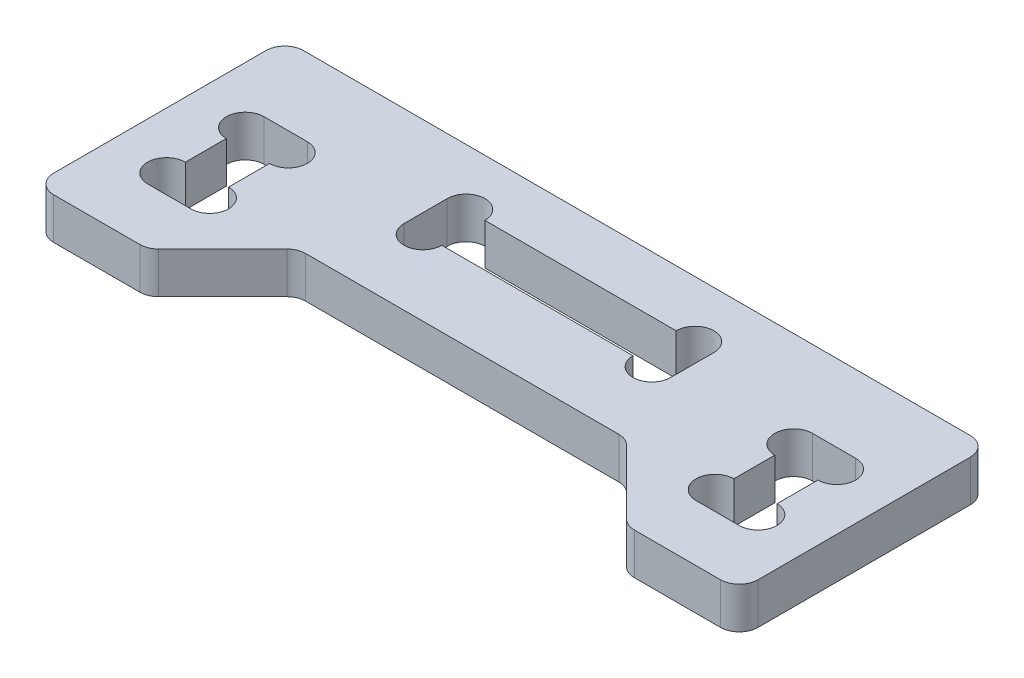
from build123d import *

# Parameters (mm, degrees)
EXTRUDE_1_DEPTH = 2.2
FILLET_1_R      = 1


with BuildPart() as part:
    # 草图1 → 凸台-拉伸1 (new body)
    with BuildSketch(Plane(origin=(0, 0, 0), x_dir=(1, 0, 0), z_dir=(0, 1, 0))):
        Polygon((18.75, 4.15), (-18.75, 4.15), (-18.75, -9.15), (-12.75, -9.15), (-8.75, -5.15), (8.75, -5.15), (12.75, -9.15), (18.75, -9.15), align=None)
        with BuildLine():
            Line((-13.45, -6.15), (-15.75, -6.15))
            ThreePointArc((-15.75, -6.15), (-16.755, -5.145), (-15.75, -4.14))
            Line((-15.75, -4.14), (-15.75, -1.96))
            ThreePointArc((-15.75, -1.96), (-16.755, -0.955), (-15.75, 0.05))
            Line((-15.75, 0.05), (-13.45, 0.05))
            ThreePointArc((-13.45, 0.05), (-12.739357685, -0.244357685), (-12.445, -0.955))
            ThreePointArc((-12.445, -0.955), (-12.739357685, -1.665642315), (-13.45, -1.96))
            Line((-13.45, -1.96), (-13.45, -4.14))
            ThreePointArc((-13.45, -4.14), (-12.739357685, -4.434357685), (-12.445, -5.145))
            ThreePointArc((-12.445, -5.145), (-12.739357685, -5.855642315), (-13.45, -6.15))
        make_face(mode=Mode.SUBTRACT)
        with BuildLine():
            Line((13.45, 0.05), (15.75, 0.05))
            ThreePointArc((15.75, 0.05), (16.460642315, -0.244357685), (16.755, -0.955))
            ThreePointArc((16.755, -0.955), (16.460642315, -1.665642315), (15.75, -1.96))
            Line((15.75, -1.96), (15.75, -4.14))
            ThreePointArc((15.75, -4.14), (16.460642315, -4.434357685), (16.755, -5.145))
            ThreePointArc((16.755, -5.145), (16.460642315, -5.855642315), (15.75, -6.15))
            Line((15.75, -6.15), (13.45, -6.15))
            ThreePointArc((13.45, -6.15), (12.445, -5.145), (13.45, -4.14))
            Line((13.45, -4.14), (13.45, -1.96))
            ThreePointArc((13.45, -1.96), (12.445, -0.955), (13.45, 0.05))
        make_face(mode=Mode.SUBTRACT)
        with BuildLine():
            Line((5.09, -1.15), (-5.09, -1.15))
            ThreePointArc((-5.09, -1.15), (-6.095, -2.155), (-7.1, -1.15))
            Line((-7.1, -1.15), (-7.1, 1.15))
            ThreePointArc((-7.1, 1.15), (-6.095, 2.155), (-5.09, 1.15))
            Line((-5.09, 1.15), (5.09, 1.15))
            ThreePointArc((5.09, 1.15), (6.095, 2.155), (7.1, 1.15))
            Line((7.1, 1.15), (7.1, -1.15))
            ThreePointArc((7.1, -1.15), (6.095, -2.155), (5.09, -1.15))
        make_face(mode=Mode.SUBTRACT)
    extrude(amount=EXTRUDE_1_DEPTH)

    # 圆角1
    fillet_1_edges = [part.edges().sort_by_distance(p)[0] for p in [
        (-18.75, 1.1, 9.15),
        (-18.75, 1.1, -4.15),
        (18.75, 1.1, -4.15),
        (18.75, 1.1, 9.15),
        (12.75, 1.1, 9.15),
        (8.75, 1.1, 5.15),
        (-8.75, 1.1, 5.15),
        (-12.75, 1.1, 9.15),
    ]]
    fillet(fillet_1_edges, radius=FILLET_1_R)


solid = part.part
